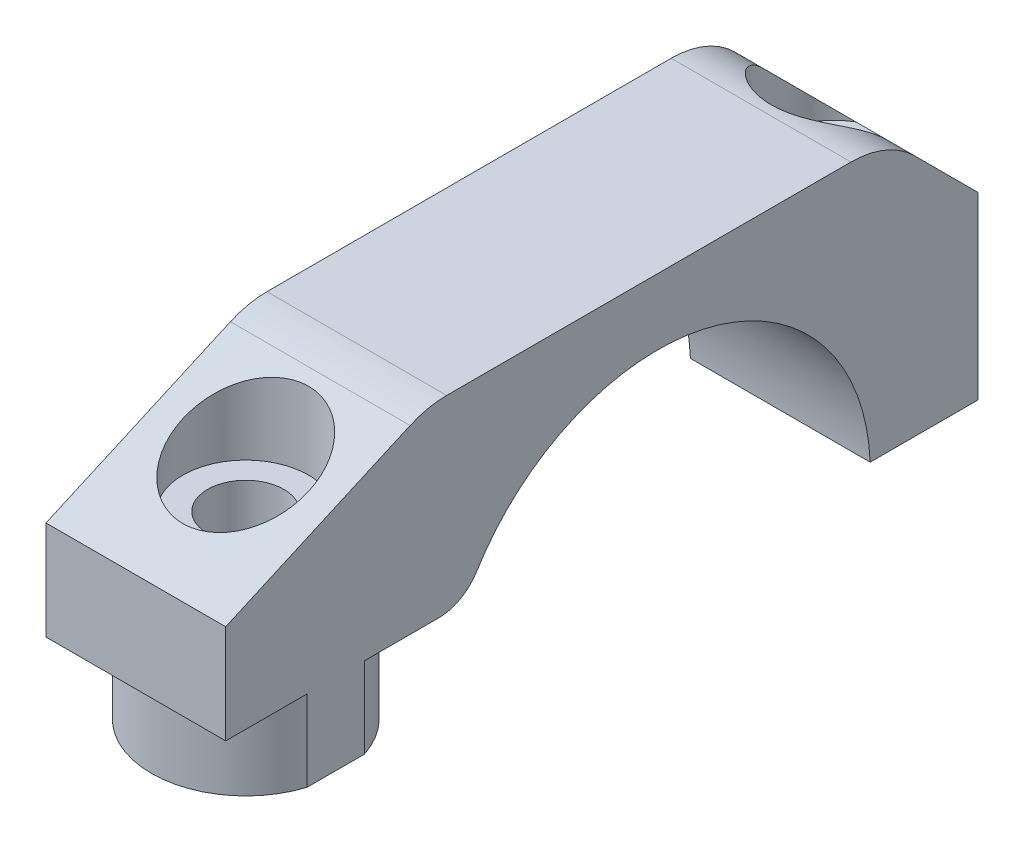
from build123d import *

# Parameters (mm, degrees)
BOSS_EXTRUDE1_DEPTH        = 20
CHAMFER1_SIZE              = 10
CHAMFER2_SIZE              = 10
CHAMFER2_SIZE2             = 22.460367739
FILLET2_R                  = 10
FILLET3_R                  = 5
F_8_5_8_5_DIAMETER_HOLE1_D = 8.5
SKETCH6_R                  = 7
CUT_EXTRUDE1_DEPTH         = 10
SKETCH7_R                  = 22.103989718
SKETCH7_R_2                = 10.5
CUT_EXTRUDE2_DEPTH         = 9


with BuildPart() as part:
    # Sketch1 → Boss-Extrude1 (new body)
    with BuildSketch(Plane(origin=(0, 0, 0), x_dir=(0, 0, -1), z_dir=(1, 0, 0))):
        with BuildLine():
            Line((-35.628848893, 0), (35.628848893, 0))
            Line((35.628848893, 0), (35.628848893, -30))
            Line((35.628848893, -30), (23.628848893, -30))
            ThreePointArc((23.628848893, -30), (4.632142534, -7.808067016), (-21.431810469, -21))
            Line((-21.431810469, -21), (-24.628848893, -21))
            Line((-24.628848893, -21), (-24.628848893, -30))
            Line((-24.628848893, -30), (-48.083267238, -30))
            Line((-48.083267238, -30), (-48.083267238, 0))
            Line((-48.083267238, 0), (-35.628848893, 0))
        make_face()
    extrude(amount=BOSS_EXTRUDE1_DEPTH)

    # Chamfer1
    chamfer1_edges = [part.edges().sort_by_distance(p)[0] for p in [
        (10, 0, -35.628848893),
    ]]
    chamfer(chamfer1_edges, length=CHAMFER1_SIZE)

    # Chamfer2
    chamfer2_edges = [part.edges().sort_by_distance(p)[0] for p in [
        (10, 0, 48.083267238),
    ]]
    chamfer2_side = [part.faces().sort_by_distance(p)[0] for p in [
        (10, -15, 48.083267238),
    ]]
    chamfer(chamfer2_edges, length=CHAMFER2_SIZE, length2=CHAMFER2_SIZE2, reference=chamfer2_side[0])

    # Fillet2
    fillet2_edges = [part.edges().sort_by_distance(p)[0] for p in [
        (10, 0, -25.628848893),
        (10, 0, 25.622899499),
    ]]
    fillet(fillet2_edges, radius=FILLET2_R)

    # Fillet3
    fillet3_edges = [part.edges().sort_by_distance(p)[0] for p in [
        (10, -21, 21.431810469),
    ]]
    fillet(fillet3_edges, radius=FILLET3_R)

    # Ø8.5 (8.5) Diameter Hole1 (through all)
    with Locations(Plane(origin=(0, -30, 0), x_dir=(-1, 0, 0), z_dir=(0, -1, 0))):
        with Locations((-10, -35.856058066), (-10, 29.628848893)):
            Hole(F_8_5_8_5_DIAMETER_HOLE1_D / 2)

    # Sketch6 → Cut-Extrude1 (cut)
    with BuildSketch(Plane(origin=(0, 0, 0), x_dir=(1, 0, 0), z_dir=(0, 1, 0))):
        with Locations(Location((10, -35.856058066, 0), (0, 0, 270))):
            Circle(SKETCH6_R)
        with Locations((10, 29.628848893)):
            Circle(SKETCH6_R)
    extrude(amount=-CUT_EXTRUDE1_DEPTH, mode=Mode.SUBTRACT)

    # Sketch7 → Cut-Extrude2 (cut)
    with BuildSketch(Plane.XZ.offset(30)):
        with Locations((10, 35.856058066)):
            Circle(SKETCH7_R)
        with Locations((10, 35.856058066)):
            Circle(SKETCH7_R_2, mode=Mode.SUBTRACT)
    extrude(amount=-CUT_EXTRUDE2_DEPTH, mode=Mode.SUBTRACT)


solid = part.part
